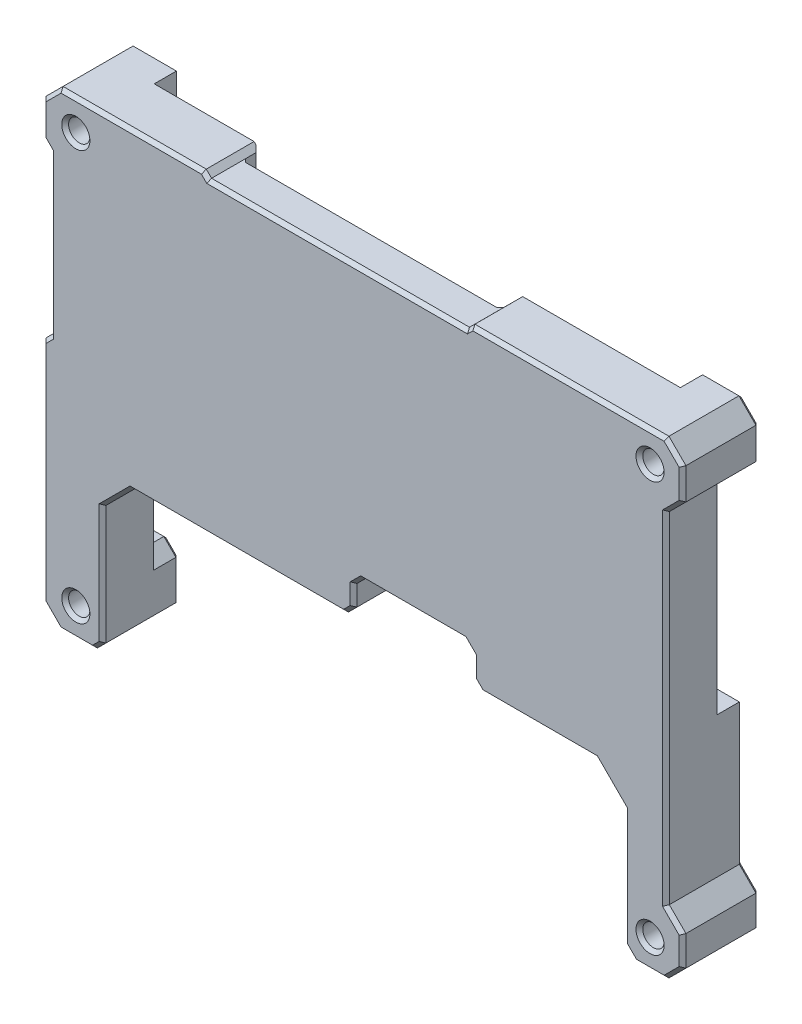
from build123d import *

# Parameters (mm, degrees)
SKETCH_1_W           = 85
SKETCH_1_H           = 65
EXTRUDE_1_DEPTH      = 10
CUT_EXTRUDE_1_REACH  = 109.471
SKETCH_2_R           = 1.25
CUT_EXTRUDE_2_REACH  = 109.471
SKETCH_3_W           = 85
SKETCH_3_H           = 65
CUT_EXTRUDE_4_REACH  = 102.464
CUT_EXTRUDE_7_DEPTH  = 6
CUT_EXTRUDE_8_DEPTH  = 6
CUT_EXTRUDE_11_DEPTH = 4
SKETCH_8_W           = 8
SKETCH_8_H           = 5
CUT_EXTRUDE_12_DEPTH = 1
SKETCH_10_W          = 5.4
SKETCH_10_H          = 6
SKETCH_10_W_2        = 4
EXTRUDE_2_DEPTH      = 2.040000001
SKETCH_11_W          = 4.2
SKETCH_11_H          = 5
EXTRUDE_3_DEPTH      = 1.300114616
SKETCH_12_W          = 12
SKETCH_12_H          = 6
EXTRUDE_4_DEPTH      = 2.040000001
SKETCH_13_W          = 3.114456334
SKETCH_13_H          = 4.982674998
EXTRUDE_5_DEPTH      = 2
SKETCH_15_W          = 14
SKETCH_15_H          = 4.4
CUT_EXTRUDE_13_DEPTH = 6
CHAMFER_1_SIZE       = 1
CHAMFER_2_SIZE       = 0.6
CHAMFER_5_SIZE       = 0.6
CUT_EXTRUDE_15_DEPTH = 4
CUT_EXTRUDE_16_DEPTH = 4
CHAMFER_6_SIZE       = 0.4
CHAMFER_7_SIZE       = 0.4
CHAMFER_8_SIZE       = 0.4
CHAMFER_9_SIZE       = 0.4
CHAMFER_11_SIZE      = 0.4
SKETCH_19_W          = 9.4
SKETCH_19_H          = 8.4
CUT_EXTRUDE_17_DEPTH = 2.4
CHAMFER_12_SIZE      = 0.4
CHAMFER_14_SIZE      = 0.4
CHAMFER_15_SIZE      = 0.4
SKETCH_20_R          = 1.25
CUT_EXTRUDE_18_DEPTH = 1
CHAMFER_16_SIZE      = 0.4


with BuildPart() as part:
    # 草图1 → 凸台-拉伸1 (new body)
    with BuildSketch(Plane.XY):
        with Locations((42.5, 32.5)):
            Rectangle(SKETCH_1_W, SKETCH_1_H)
    extrude(amount=EXTRUDE_1_DEPTH)

    # 草图2 → 切除-拉伸1 (cut, up to next)
    with BuildSketch(Plane(origin=(0, 0, 0), x_dir=(-1, 0, 0), z_dir=(0, 0, -1)), mode=Mode.PRIVATE) as cut_extrude_1_sk1:
        with Locations((-76.166921514, 56.442524765)):
            Circle(SKETCH_2_R)
    cut_extrude_1_tool1 = extrude(cut_extrude_1_sk1.sketch, amount=-CUT_EXTRUDE_1_REACH, mode=Mode.PRIVATE) & part.part
    # 草图2 → 切除-拉伸1 (cut, up to next)
    with BuildSketch(Plane(origin=(0, 0, 0), x_dir=(-1, 0, 0), z_dir=(0, 0, -1)), mode=Mode.PRIVATE) as cut_extrude_1_sk2:
        with Locations((-8.888803658, 56.442524765)):
            Circle(SKETCH_2_R)
    cut_extrude_1_tool2 = extrude(cut_extrude_1_sk2.sketch, amount=-CUT_EXTRUDE_1_REACH, mode=Mode.PRIVATE) & part.part
    # 草图2 → 切除-拉伸1 (cut, up to next)
    with BuildSketch(Plane(origin=(0, 0, 0), x_dir=(-1, 0, 0), z_dir=(0, 0, -1)), mode=Mode.PRIVATE) as cut_extrude_1_sk3:
        with Locations((-76.166921514, 8.41508509)):
            Circle(SKETCH_2_R)
    cut_extrude_1_tool3 = extrude(cut_extrude_1_sk3.sketch, amount=-CUT_EXTRUDE_1_REACH, mode=Mode.PRIVATE) & part.part
    # 草图2 → 切除-拉伸1 (cut, up to next)
    with BuildSketch(Plane(origin=(0, 0, 0), x_dir=(-1, 0, 0), z_dir=(0, 0, -1)), mode=Mode.PRIVATE) as cut_extrude_1_sk4:
        with Locations((-8.888803658, 8.41508509)):
            Circle(SKETCH_2_R)
    cut_extrude_1_tool4 = extrude(cut_extrude_1_sk4.sketch, amount=-CUT_EXTRUDE_1_REACH, mode=Mode.PRIVATE) & part.part
    add(cut_extrude_1_tool1.solids().sort_by_distance((76.166922, 56.442525, 0))[0], mode=Mode.SUBTRACT)
    add(cut_extrude_1_tool2.solids().sort_by_distance((8.888804, 56.442525, 0))[0], mode=Mode.SUBTRACT)
    add(cut_extrude_1_tool3.solids().sort_by_distance((76.166922, 8.415085, 0))[0], mode=Mode.SUBTRACT)
    add(cut_extrude_1_tool4.solids().sort_by_distance((8.888804, 8.415085, 0))[0], mode=Mode.SUBTRACT)

    # 草图3 → 切除-拉伸2 (cut, up to next)
    with BuildSketch(Plane(origin=(0, 0, 0), x_dir=(-1, 0, 0), z_dir=(0, 0, -1)), mode=Mode.PRIVATE) as cut_extrude_2_sk1:
        with Locations((-42.5, 32.5)):
            Rectangle(SKETCH_3_W, SKETCH_3_H)
        Polygon((-5, 33.462892894), (-5.871324699, 34.334217592), (-5.87504445, 53.137061214), (-5, 54.017366187), (-5, 57.982143592), (-6.992565577, 59.974709169), (-23.773560915, 59.974709169), (-24.394872914, 59.353397171), (-54.61482093, 59.349677419), (-55.245113202, 59.974709169), (-77.982184232, 59.974709169), (-79.974749809, 57.982143592), (-79.97474981, 54.295829484), (-78.032030648, 52.353110322), (-78.028310897, 12.45999492), (-79.97474981, 10.508295484), (-79.97474981, 6.992565577), (-77.982184232, 5), (-74.414239441, 5), (-73.152434681, 6.26180476), (-60.043505207, 6.265524511), (-58.772720173, 5), (-32.926479725, 5), (-31.743585303, 6.182894422), (-17.461559563, 6.186614173), (-16.269684867, 5), (-6.992565577, 5), (-5, 6.992565577), align=None, mode=Mode.SUBTRACT)
    cut_extrude_2_tool1 = extrude(cut_extrude_2_sk1.sketch, amount=-CUT_EXTRUDE_2_REACH, mode=Mode.PRIVATE) & part.part
    add(cut_extrude_2_tool1.solids().sort_by_distance((42.5, 63.929953, 0))[0], mode=Mode.SUBTRACT)

    # 草图4 → 切除-拉伸4 (cut, up to next)
    with BuildSketch(Plane(origin=(0, 0, 0), x_dir=(-1, 0, 0), z_dir=(0, 0, -1)), mode=Mode.PRIVATE) as cut_extrude_4_sk1:
        Polygon((-73.152434681, 6.26180476), (-73.152434681, 20.032317315), (-69.831576581, 23.353175415), (-46.787984184, 23.353175415), (-15.403761553, 23.353175415), (-12.014024846, 19.963438707), (-12.014024846, 6.188032983), (-12.014024846, 0.193960815), (-73.152434681, 0.193960815), align=None)
    cut_extrude_4_tool1 = extrude(cut_extrude_4_sk1.sketch, amount=-CUT_EXTRUDE_4_REACH, mode=Mode.PRIVATE) & part.part
    add(cut_extrude_4_tool1.solids().sort_by_distance((42.587983, 11.689717, 0))[0], mode=Mode.SUBTRACT)

    # 草图5 → 切除-拉伸7 (cut)
    with BuildSketch(Plane(origin=(0, 0, 0), x_dir=(-1, 0, 0), z_dir=(0, 0, -1))):
        Polygon((-24.394872914, 59.353397171), (-24.394872914, 53.906418167), (-25.526104495, 52.774908066), (-53.482640788, 52.774908066), (-54.614150889, 53.906139647), (-54.61482093, 59.349677419), align=None)
    extrude(amount=-CUT_EXTRUDE_7_DEPTH, mode=Mode.SUBTRACT)

    # 草图6 → 切除-拉伸8 (cut)
    with BuildSketch(Plane(origin=(0, 0, 0), x_dir=(-1, 0, 0), z_dir=(0, 0, -1))):
        Polygon((-5.871324699, 34.334217592), (-11.671324699, 34.334217592), (-11.671324699, 50.334217592), (-5.874489966, 50.334217592), (-5.873484235, 45.250384759), align=None)
    extrude(amount=-CUT_EXTRUDE_8_DEPTH, mode=Mode.SUBTRACT)

    # 草图7 → 切除-拉伸11 (cut)
    with BuildSketch(Plane(origin=(0, 0, 0), x_dir=(-1, 0, 0), z_dir=(0, 0, -1))):
        Polygon((-74.432117646, 51.26230094), (-76.432117646, 51.26230094), (-78.031928938, 51.26230094), (-78.029847328, 28.93771831), (-75.029847328, 28.93771831), (-75.029847328, 13.93771831), (-73.152434681, 12.060305663), (-73.152434681, 20.032317315), (-69.831576581, 23.353175415), (-15.403761553, 23.353175415), (-12.014024846, 19.963438707), (-12.014024846, 10.599811284), (-10.599811284, 12.014024847), (-6.599811284, 12.014024847), (-5, 12.014024847), (-5, 33.462892894), (-5.871324699, 34.334217592), (-11.671324699, 34.334217592), (-11.671324699, 50.334217592), (-5.874489966, 50.334217592), (-5.87504445, 53.137061214), (-9.87504445, 53.137061214), (-12.071959353, 55.333976117), (-12.071959353, 58.333976117), (-23.061659554, 58.333976117), (-23.732127818, 57.663342778), (-24.394872914, 57.663261201), (-24.394872914, 53.906418167), (-25.526104495, 52.774908066), (-53.482640788, 52.774908066), (-54.614150889, 53.906139647), (-54.61482093, 59.349677419), (-55.245113202, 59.974709169), (-71.319520701, 59.974709169), (-71.319520701, 58.374897885), (-71.319520701, 54.374897885), align=None)
    extrude(amount=-CUT_EXTRUDE_11_DEPTH, mode=Mode.SUBTRACT)

    # 草图8 → 切除-拉伸12 (cut)
    with BuildSketch(Plane(origin=(0, 0, 4), x_dir=(-1, 0, 0), z_dir=(0, 0, -1))):
        with Locations((-69.348077333, 43.45871309)):
            Rectangle(SKETCH_8_W, SKETCH_8_H)
    extrude(amount=-CUT_EXTRUDE_12_DEPTH, mode=Mode.SUBTRACT)

    # 草图10 → 凸台-拉伸2 (add)
    with BuildSketch(Plane(origin=(0, 0, 4), x_dir=(-1, 0, 0), z_dir=(0, 0, -1))):
        with Locations((-44.246532103, 31.889800214)):
            Rectangle(SKETCH_10_W, SKETCH_10_H)
        with Locations((-39.546532103, 31.889800214)):
            Rectangle(SKETCH_10_W_2, SKETCH_10_H)
        with Locations((-34.846532103, 31.889800214)):
            Rectangle(SKETCH_10_W, SKETCH_10_H)
    extrude(amount=EXTRUDE_2_DEPTH)

    # 草图11 → 凸台-拉伸3 (add)
    with BuildSketch(Plane(origin=(0, 0, 4), x_dir=(-1, 0, 0), z_dir=(0, 0, -1))):
        with Locations((-38.731800654, 41.192864876)):
            Rectangle(SKETCH_11_W, SKETCH_11_H)
    extrude(amount=EXTRUDE_3_DEPTH)

    # 草图12 → 凸台-拉伸4 (add)
    with BuildSketch(Plane(origin=(0, 0, 4), x_dir=(-1, 0, 0), z_dir=(0, 0, -1))):
        with Locations((-24.610605003, 27.685920752)):
            Rectangle(SKETCH_12_W, SKETCH_12_H)
        Polygon((-30.610605003, 30.685920752), (-24.610605003, 30.685920752), (-32.146532103, 34.889800214), (-32.146532103, 28.889800214), (-30.610605003, 27.685920752), align=None)
    extrude(amount=EXTRUDE_4_DEPTH)

    # 草图13 → 凸台-拉伸5 (add)
    with BuildSketch(Plane(origin=(0, 0, 4), x_dir=(-1, 0, 0), z_dir=(0, 0, -1))):
        with Locations((-61.333013133, 38.127509711)):
            Rectangle(SKETCH_13_W, SKETCH_13_H)
    extrude(amount=EXTRUDE_5_DEPTH)

    # 草图15 → 切除-拉伸13 (cut)
    with BuildSketch(Plane.XY.offset(10)):
        with Locations((48.428848604, 25.553175415)):
            Rectangle(SKETCH_15_W, SKETCH_15_H)
    extrude(amount=-CUT_EXTRUDE_13_DEPTH, mode=Mode.SUBTRACT)

    # 倒角1
    chamfer_1_edges = [part.edges().sort_by_distance(p)[0] for p in [
        (12.014024846, 5, 5),
        (55.428848604, 23.353175415, 7),
        (55.428848604, 27.753175415, 7),
        (41.428848604, 27.753175415, 7),
        (41.428848604, 23.353175415, 7),
    ]]
    chamfer(chamfer_1_edges, length=CHAMFER_1_SIZE)

    # 倒角2
    chamfer_2_edges = [part.edges().sort_by_distance(p)[0] for p in [
        (62.8902413, 38.127509711, 4),
        (61.333013133, 35.636172212, 4),
        (59.775784966, 38.127509711, 4),
        (61.333013133, 40.61884721, 4),
    ]]
    chamfer(chamfer_2_edges, length=CHAMFER_2_SIZE)

    # 倒角5
    chamfer_5_edges = [part.edges().sort_by_distance(p)[0] for p in [
        (38.731800654, 43.692864876, 4),
        (36.631800654, 41.192864876, 4),
        (38.731800654, 38.692864876, 4),
        (40.831800654, 41.192864876, 4),
    ]]
    chamfer(chamfer_5_edges, length=CHAMFER_5_SIZE)

    # 草图17 → 切除-拉伸15 (cut)
    with BuildSketch(Plane(origin=(0, 0, 0), x_dir=(-1, 0, 0), z_dir=(0, 0, -1))):
        Polygon((-23.061659554, 58.333976117), (-12.071959353, 58.333976117), (-12.071959353, 59.974709169), (-23.773560915, 59.974709169), (-24.394872914, 59.353397171), (-24.394872914, 57.663261201), (-23.732127818, 57.663342778), align=None)
    extrude(amount=-CUT_EXTRUDE_15_DEPTH, mode=Mode.SUBTRACT)

    # 草图18 → 切除-拉伸16 (cut)
    with BuildSketch(Plane(origin=(0, 0, 0), x_dir=(-1, 0, 0), z_dir=(0, 0, -1))):
        Polygon((-71.319520701, 59.974709169), (-73.719520701, 59.974709169), (-73.719520701, 54.050166597), (-75.416576976, 52.353110322), (-78.032030648, 52.353110322), (-78.031928938, 51.26230094), (-74.432117646, 51.26230094), (-71.319520701, 54.374897885), align=None)
    extrude(amount=-CUT_EXTRUDE_16_DEPTH, mode=Mode.SUBTRACT)

    # 倒角6
    chamfer_6_edges = [part.edges().sort_by_distance(p)[0] for p in [
        (73.152434681, 13.147061037, 10),
        (71.492005631, 21.692746365, 10),
        (63.130212592, 23.353175415, 10),
        (13.7088932, 21.658307061, 10),
        (12.014024846, 12.981719354, 10),
        (10.138803658, 56.442524765, 10),
        (77.416921514, 8.41508509, 10),
        (10.138803658, 8.41508509, 10),
        (77.416921514, 56.442524765, 10),
        (48.428848604, 27.753175415, 10),
        (55.428848604, 25.553175415, 10),
        (27.916305079, 23.353175415, 10),
        (41.428848604, 25.553175415, 10),
        (55.928848604, 23.853175415, 10),
        (40.928848604, 23.853175415, 10),
        (11.514024846, 5.5, 10),
        (41.928848604, 27.253175415, 10),
        (54.928848604, 27.253175415, 10),
        (5.873184574, 43.735639403, 10),
        (5.435662349, 33.898555243, 10),
        (5, 20.227729235, 10),
        (5.996282789, 5.996282789, 10),
        (9.003295212, 5, 10),
        (73.783337061, 5.63090238, 10),
        (76.198211836, 5, 10),
        (78.978467021, 5.996282789, 10),
        (79.97474981, 8.750430531, 10),
        (79.001530353, 11.484145202, 10),
        (78.030170772, 32.406552621, 10),
        (79.003390229, 53.324469903, 10),
        (79.974749809, 56.138986538, 10),
        (78.978467021, 58.978426381, 10),
        (66.613648717, 59.974709169, 10),
        (54.929967066, 59.662193294, 10),
        (39.504846922, 59.351537295, 10),
        (24.084216914, 59.66405317, 10),
        (15.383063246, 59.974709169, 10),
        (5.996282789, 58.978426381, 10),
        (5, 55.99975489, 10),
        (5.437522225, 53.577213701, 10),
    ]]
    chamfer(chamfer_6_edges, length=CHAMFER_6_SIZE)

    # 倒角7
    chamfer_7_edges = [part.edges().sort_by_distance(p)[0] for p in [
        (38.731800654, 43.692864876, 2.699885384),
        (36.631800654, 41.192864876, 2.699885384),
        (38.731800654, 38.692864876, 2.699885384),
        (40.831800654, 41.192864876, 2.699885384),
        (62.8902413, 38.127509711, 2),
        (61.333013133, 35.636172212, 2),
        (59.775784966, 38.127509711, 2),
        (61.333013133, 40.61884721, 2),
    ]]
    chamfer(chamfer_7_edges, length=CHAMFER_7_SIZE)

    # 倒角8
    chamfer_8_edges = [part.edges().sort_by_distance(p)[0] for p in [
        (8.771324699, 34.334217592, 6),
        (11.671324699, 42.334217592, 6),
        (11.671324699, 34.334217592, 5),
        (8.772907332, 50.334217592, 6),
        (11.671324699, 50.334217592, 5),
        (8.772907332, 50.334217592, 4),
        (11.671324699, 42.334217592, 4),
        (8.771324699, 34.334217592, 4),
    ]]
    chamfer(chamfer_8_edges, length=CHAMFER_8_SIZE)

    # 倒角9
    chamfer_9_edges = [part.edges().sort_by_distance(p)[0] for p in [
        (24.394872914, 56.629907669, 6),
        (24.960488704, 53.340663116, 6),
        (39.504372641, 52.774908066, 6),
        (54.048395838, 53.340523857, 6),
        (54.614485909, 56.627908533, 6),
        (54.614485909, 56.627908533, 4),
        (54.048395838, 53.340523857, 4),
        (39.504372641, 52.774908066, 4),
        (24.960488704, 53.340663116, 4),
        (24.394872914, 56.629907669, 4),
    ]]
    chamfer(chamfer_9_edges, length=CHAMFER_9_SIZE)

    # 倒角11
    chamfer_11_edges = [part.edges().sort_by_distance(p)[0] for p in [
        (73.348077333, 43.45871309, 5),
        (69.348077333, 45.95871309, 5),
        (65.348077333, 43.45871309, 5),
        (69.348077333, 40.95871309, 5),
    ]]
    chamfer(chamfer_11_edges, length=CHAMFER_11_SIZE)

    # 草图19 → 切除-拉伸17 (cut)
    with BuildSketch(Plane(origin=(0, 0, 4), x_dir=(-1, 0, 0), z_dir=(0, 0, -1))):
        with Locations((-62.931576581, 27.553175415)):
            Rectangle(SKETCH_19_W, SKETCH_19_H)
    extrude(amount=-CUT_EXTRUDE_17_DEPTH, mode=Mode.SUBTRACT)

    # 倒角12
    chamfer_12_edges = [part.edges().sort_by_distance(p)[0] for p in [
        (67.631576581, 27.553175415, 6.4),
        (67.631576581, 23.353175415, 5.2),
        (62.931576581, 31.753175415, 6.4),
        (67.631576581, 31.753175415, 5.2),
        (58.231576581, 27.553175415, 6.4),
        (58.231576581, 31.753175415, 5.2),
        (62.931576581, 23.353175415, 6.4),
        (58.231576581, 23.353175415, 5.2),
        (67.631576581, 27.553175415, 4),
        (58.231576581, 27.553175415, 4),
        (62.931576581, 31.753175415, 4),
    ]]
    chamfer(chamfer_12_edges, length=CHAMFER_12_SIZE)

    # 倒角14
    chamfer_14_edges = [part.edges().sort_by_distance(p)[0] for p in [
        (46.946532103, 31.889800214, 1.959999999),
        (39.546532103, 28.889800214, 1.959999999),
        (39.546532103, 34.889800214, 1.959999999),
        (28.378568553, 32.787860483, 1.959999999),
        (31.378568553, 28.287860483, 1.959999999),
        (30.610605003, 26.185920752, 1.959999999),
        (24.610605003, 24.685920752, 1.959999999),
        (21.610605003, 30.685920752, 1.959999999),
        (18.610605003, 27.685920752, 1.959999999),
    ]]
    chamfer(chamfer_14_edges, length=CHAMFER_14_SIZE)

    # 倒角15
    chamfer_15_edges = [part.edges().sort_by_distance(p)[0] for p in [
        (39.546532103, 34.889800214, 4),
        (46.946532103, 31.889800214, 4),
        (39.546532103, 28.889800214, 4),
        (28.378568553, 32.787860483, 4),
        (31.378568553, 28.287860483, 4),
        (30.610605003, 26.185920752, 4),
        (24.610605003, 24.685920752, 4),
        (21.610605003, 30.685920752, 4),
        (18.610605003, 27.685920752, 4),
    ]]
    chamfer(chamfer_15_edges, length=CHAMFER_15_SIZE)

    # 草图20 → 切除-拉伸18 (cut)
    # profile 1 of 4: a face of its own
    with BuildSketch(Plane(origin=(0, 0, 0), x_dir=(-1, 0, 0), z_dir=(0, 0, -1))):
        Polygon((-6.992565577, 59.974709169), (-12.071959353, 59.974709169), (-12.071959353, 55.333976117), (-9.87504445, 53.137061214), (-5.87504445, 53.137061214), (-5, 54.017366187), (-5, 57.982143592), align=None)
        with Locations((-8.888803658, 56.442524765)):
            Circle(SKETCH_20_R, mode=Mode.SUBTRACT)
    # profile 2 of 4: a face of its own
    with BuildSketch(Plane(origin=(0, 0, 0), x_dir=(-1, 0, 0), z_dir=(0, 0, -1))):
        Polygon((-73.719520701, 54.050166597), (-73.719520701, 59.974709169), (-77.982184232, 59.974709169), (-79.974749809, 57.982143592), (-79.97474981, 54.295829484), (-78.032030648, 52.353110322), (-75.416576976, 52.353110322), align=None)
        with Locations((-76.166921514, 56.442524765)):
            Circle(SKETCH_20_R, mode=Mode.SUBTRACT)
    # profile 3 of 4: a face of its own
    with BuildSketch(Plane(origin=(0, 0, 0), x_dir=(-1, 0, 0), z_dir=(0, 0, -1))):
        Polygon((-73.152434681, 6.26180476), (-73.152434681, 12.060305663), (-75.029847328, 13.93771831), (-75.029847328, 28.93771831), (-78.029847328, 28.93771831), (-78.028310897, 12.45999492), (-79.97474981, 10.508295484), (-79.97474981, 6.992565577), (-77.982184232, 5), (-74.414239441, 5), align=None)
        with Locations((-76.166921514, 8.41508509)):
            Circle(SKETCH_20_R, mode=Mode.SUBTRACT)
    # profile 4 of 4: a face of its own
    with BuildSketch(Plane(origin=(0, 0, 0), x_dir=(-1, 0, 0), z_dir=(0, 0, -1))):
        Polygon((-12.014024846, 10.599811286), (-12.014024846, 6), (-11.014024846, 5), (-6.992565577, 5), (-5, 6.992565577), (-5, 12.014024847), (-10.599811284, 12.014024847), align=None)
        with Locations((-8.888803658, 8.41508509)):
            Circle(SKETCH_20_R, mode=Mode.SUBTRACT)
    extrude(amount=-CUT_EXTRUDE_18_DEPTH, mode=Mode.SUBTRACT)

    # 倒角16
    chamfer_16_edges = [part.edges().sort_by_distance(p)[0] for p in [
        (10.138803658, 56.442524765, 1),
        (5, 55.99975489, 1),
        (5.437522225, 53.577213701, 1),
        (7.87504445, 53.137061214, 1),
        (10.973501901, 54.235518665, 1),
        (12.071959353, 57.654342643, 1),
        (9.532262465, 59.974709169, 1),
        (5.996282789, 58.978426381, 1),
        (11.306918065, 11.306918066, 1),
        (7.799905642, 12.014024847, 1),
        (5, 9.503295212, 1),
        (5.996282789, 5.996282789, 1),
        (9.003295212, 5, 1),
        (11.514024846, 5.5, 1),
        (12.014024846, 8.299905643, 1),
        (10.138803658, 8.41508509, 1),
        (77.416921514, 8.41508509, 1),
        (76.198211836, 5, 1),
        (78.978467021, 5.996282789, 1),
        (79.97474981, 8.750430531, 1),
        (79.001530353, 11.484145202, 1),
        (78.029079112, 20.698856615, 1),
        (76.529847328, 28.93771831, 1),
        (75.029847328, 21.43771831, 1),
        (74.091141004, 12.999011987, 1),
        (73.152434681, 9.161055212, 1),
        (73.783337061, 5.63090238, 1),
        (77.416921514, 56.442524765, 1),
        (76.724303812, 52.353110322, 1),
        (79.003390229, 53.324469903, 1),
        (79.974749809, 56.138986538, 1),
        (78.978467021, 58.978426381, 1),
        (75.850852466, 59.974709169, 1),
        (73.719520701, 57.012437883, 1),
        (74.568048838, 53.20163846, 1),
    ]]
    chamfer(chamfer_16_edges, length=CHAMFER_16_SIZE)


solid = part.part
